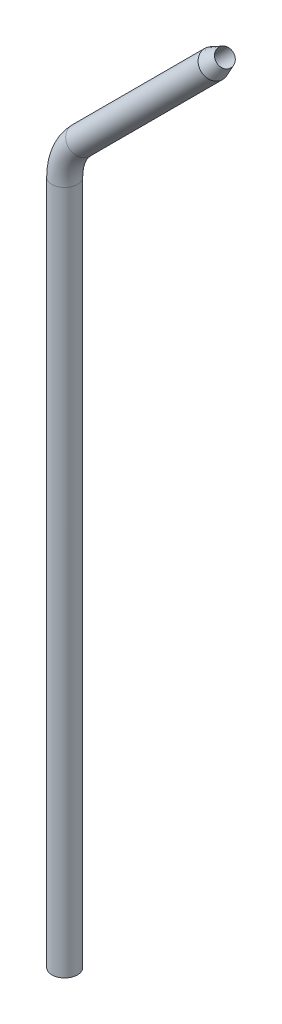
from build123d import *

# Parameters (mm, degrees)
SKETCH8_R   = 0.45
SKETCH8_R_2 = 0.3


with BuildPart() as part:
    # Sweep1: sweep along a path in Sketch7
    with BuildLine(Plane.XY) as sweep1_path:
        Line((0, 0), (0, 24.171572875))
        ThreePointArc((0, 24.171572875), (0.152240935, 24.93693974), (0.585786438, 25.585786438))
        Line((0.585786438, 25.585786438), (5.656854249, 30.656854249))
    # Sketch8 → Sweep1 (sweep)
    with BuildSketch(Plane(origin=(0, 0, 0), x_dir=(1, 0, 0), z_dir=(0, 1, 0))):
        Circle(SKETCH8_R)
        Circle(SKETCH8_R_2, mode=Mode.SUBTRACT)
    sweep(path=sweep1_path.line)

    # Sketch9 → Cut-Revolve3 (revolve, cut)
    with BuildSketch(Plane.XY):
        Polygon((5.975052301, 30.338656198), (5.868986284, 30.444722215), (5.579208536, 29.942812433), align=None)
    revolve(axis=Axis((6.207317526, 31.207317526, 0), (-0.7071067811865472, -0.7071067811865479, 0)), mode=Mode.SUBTRACT)


solid = part.part
